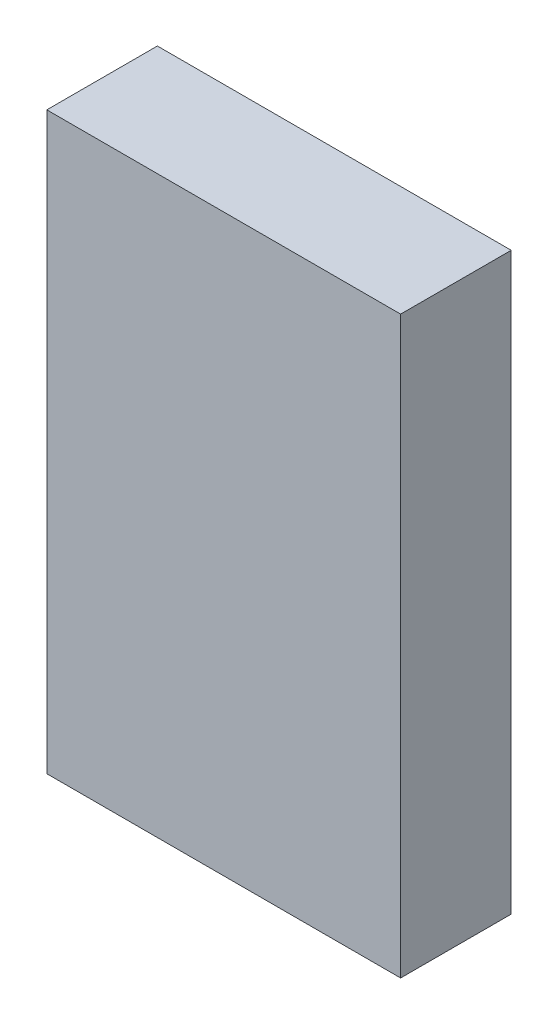
from build123d import *

# Parameters (mm, degrees)
SKETCH1_W           = 80
SKETCH1_H           = 130
BOSS_EXTRUDE1_DEPTH = 25


with BuildPart() as part:
    # Sketch1 → Boss-Extrude1 (new body)
    with BuildSketch(Plane.XY):
        with Locations((4420, 505)):
            Rectangle(SKETCH1_W, SKETCH1_H)
    extrude(amount=BOSS_EXTRUDE1_DEPTH)


solid = part.part
